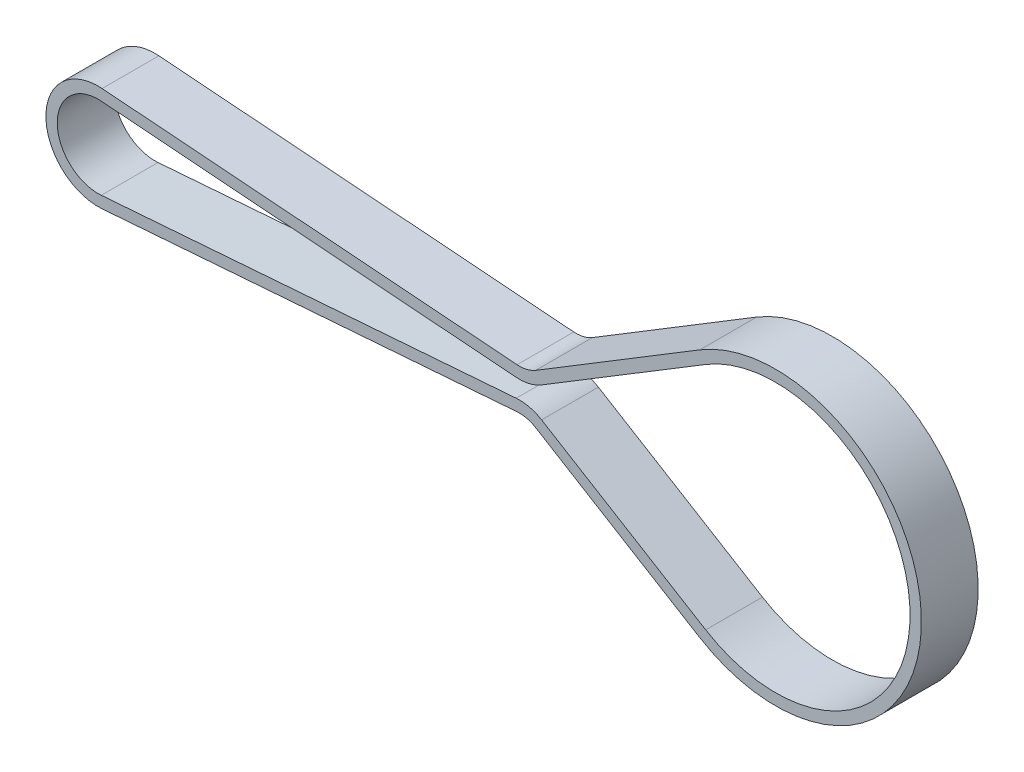
from build123d import *

# Parameters (mm, degrees)
EXTRUDE_THIN1_DEPTH      = 5.5
EXTRUDE_THIN1_DEPTH_BACK = 5.5


with BuildPart() as part:
    # Sketch2 → Extrude-Thin1 (new, two sides: drawn at the far end of the back side and taken through both)
    with BuildSketch(Plane.XY.offset(-EXTRUDE_THIN1_DEPTH_BACK)):
        with BuildLine():
            Line((81.178641225, -3.94766541), (0.77190054, -10.095533396))
            ThreePointArc((0.77190054, -10.095533396), (-10.125, -1.4295e-05), (0.771872034, 10.095535576))
            Line((0.771872034, 10.095535576), (81.178658315, 3.947892472))
            ThreePointArc((81.178658315, 3.947892472), (83.05501584, 4.097128226), (84.795440741, 4.814003411))
            Line((84.795440741, 4.814003411), (116.589341289, 24.149694959))
            ThreePointArc((116.589341289, 24.149694959), (159.541153686, -7.4103e-05), (116.589214662, -24.149617949))
            Line((116.589214662, -24.149617949), (84.795467934, -4.813791581))
            ThreePointArc((84.795467934, -4.813791581), (83.055022981, -4.096901568), (81.178641225, -3.94766541))
        make_face()
        with BuildLine():
            Line((81.010919626, -1.75406803), (0.604178941, -7.901936016))
            ThreePointArc((0.604178941, -7.901936016), (-7.925, -1.1189e-05), (0.604156629, 7.901937722))
            Line((0.604156629, 7.901937722), (81.01094291, 1.754294618))
            ThreePointArc((81.01094291, 1.754294618), (83.567364117, 1.957619113), (85.938585523, 2.934317265))
            Line((85.938585523, 2.934317265), (117.732486072, 22.270008813))
            ThreePointArc((117.732486072, 22.270008813), (157.341153686, -6.8335e-05), (117.7323693, -22.269937798))
            Line((117.7323693, -22.269937798), (85.938622573, -2.934111429))
            ThreePointArc((85.938622573, -2.934111429), (83.567373848, -1.957393075), (81.010919626, -1.75406803))
        make_face(mode=Mode.SUBTRACT)
    extrude(amount=EXTRUDE_THIN1_DEPTH + EXTRUDE_THIN1_DEPTH_BACK)


solid = part.part
